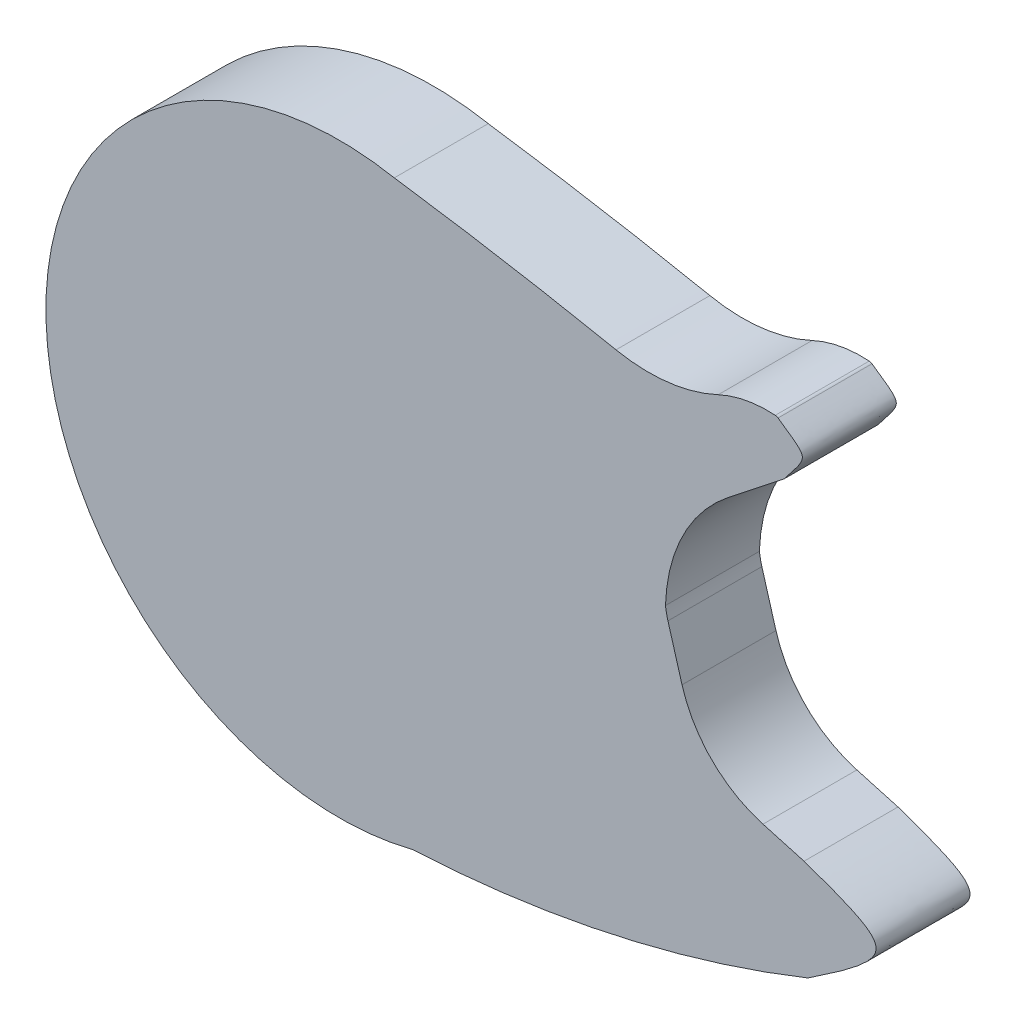
from build123d import *

# Parameters (mm, degrees)
BOSS_EXTRUDE1_DEPTH = 0.4
CUT_EXTRUDE1_DEPTH  = 0.02
CUT_EXTRUDE2_DEPTH  = 0.05


with BuildPart() as part:
    # Sketch1 → Boss-Extrude1 (new body)
    # profile 1 of 3: a face of its own
    with BuildSketch(Plane.XY):
        with BuildLine():
            Line((1.655472948, 0.75976417), (1.894411836, 0.948096738))
            add(Edge.make_bspline(
                [(1.894411836, 0.948096738), (1.995721098, 1.073095376), (1.868209238, 1.159457899)],
                knots=[0, 0, 0, 1, 1, 1], degree=2, weights=[1, 3.709412851, 1]))
            ThreePointArc((1.868209238, 1.159457899), (1.862616141, 1.162248589), (1.856487349, 1.163476835))
            ThreePointArc((1.856487349, 1.163476835), (1.731878841, 1.155950151), (1.613052317, 1.117685434))
            ThreePointArc((1.613052317, 1.117685434), (1.399671578, 1.056795841), (1.177954023, 1.065751723))
            ThreePointArc((1.177954023, 1.065751723), (0.707085833, 1.153787634), (0.233831734, 1.22793433))
            ThreePointArc((0.233831734, 1.22793433), (0.963013413, 0.796934857), (1.25, 0))
            ThreePointArc((1.25, 0), (0.987141366, -0.766845437), (0.309116921, -1.211175763))
            ThreePointArc((0.309116921, -1.211175763), (1.167763583, -1.096895018), (1.995721098, -0.842296251))
            add(Edge.make_bspline(
                [(1.995721098, -0.842296251), (2.410829332, -0.567859808), (1.978844778, -0.419894109)],
                knots=[0, 0, 0, 1, 1, 1], degree=2, weights=[1, 2.377964768, 1]))
            Line((1.978844778, -0.419894109), (1.803929697, -0.370743003))
            ThreePointArc((1.803929697, -0.370743003), (1.587306204, -0.244600422), (1.459129191, -0.029174468))
            Line((1.459129191, -0.029174468), (1.399170684, 0.176735325))
            ThreePointArc((1.399170684, 0.176735325), (1.392988311, 0.201999854), (1.389017546, 0.227704936))
            ThreePointArc((1.389017546, 0.227704936), (1.462895228, 0.523457058), (1.655472948, 0.75976417))
        make_face()
        with BuildLine():
            ThreePointArc((1.387326929, 0.252151163), (1.387922531, 0.23991078), (1.389017546, 0.227704936))
            ThreePointArc((1.389017546, 0.227704936), (1.388794522, 0.208988882), (1.389071983, 0.190273556))
            Line((1.389071983, 0.190273556), (1.387326929, 0.252151163))
        make_face(mode=Mode.SUBTRACT)
    # profile 2 of 3: a face of its own
    with BuildSketch(Plane.XY):
        with BuildLine():
            ThreePointArc((1.389071983, 0.190273556), (1.388794522, 0.208988882), (1.389017546, 0.227704936))
            ThreePointArc((1.389017546, 0.227704936), (1.387922531, 0.23991078), (1.387326929, 0.252151163))
            Line((1.387326929, 0.252151163), (1.389071983, 0.190273556))
        make_face()
    # profile 3 of 3: a face of its own
    with BuildSketch(Plane.XY):
        with BuildLine():
            ThreePointArc((1.25, 0), (0.963013413, 0.796934857), (0.233831734, 1.22793433))
            ThreePointArc((0.233831734, 1.22793433), (-1.249404987, -0.038563937), (0.309116921, -1.211175763))
            ThreePointArc((0.309116921, -1.211175763), (0.987141366, -0.766845437), (1.25, 0))
        make_face()
    extrude(amount=BOSS_EXTRUDE1_DEPTH)

    # Sketch2 → Cut-Extrude1 (cut)
    with BuildSketch(Plane(origin=(0, 0, 0), x_dir=(-1, 0, 0), z_dir=(0, 0, -1))):
        with BuildLine():
            Line((0.430503755, -0.614138842), (-0.508380064, 0.551407028))
            ThreePointArc((-0.508380064, 0.551407028), (-0.584072319, -0.470488604), (0.430503755, -0.614138842))
        make_face()
        with BuildLine():
            ThreePointArc((0.75, 0), (0.346137389, 0.665348712), (-0.430503755, 0.614138842))
            Line((-0.430503755, 0.614138842), (0.508380064, -0.551407028))
            ThreePointArc((0.508380064, -0.551407028), (0.686944338, -0.301010757), (0.75, 0))
        make_face()
    extrude(amount=-CUT_EXTRUDE1_DEPTH, mode=Mode.SUBTRACT)

    # Sketch2<3> → Cut-Extrude2 (cut)
    with BuildSketch(Plane(origin=(0, 0, 0), x_dir=(-1, 0, 0), z_dir=(0, 0, -1))):
        with BuildLine():
            ThreePointArc((-0.430503755, 0.614138842), (-0.450746943, 0.599439065), (-0.470488604, 0.584072319))
            Line((-0.470488604, 0.584072319), (0.470488604, -0.584072319))
            ThreePointArc((0.470488604, -0.584072319), (0.489706772, -0.568055699), (0.508380064, -0.551407028))
            Line((0.508380064, -0.551407028), (-0.430503755, 0.614138842))
        make_face()
        with BuildLine():
            Line((0.470488604, -0.584072319), (-0.470488604, 0.584072319))
            ThreePointArc((-0.470488604, 0.584072319), (-0.489706772, 0.568055699), (-0.508380064, 0.551407028))
            Line((-0.508380064, 0.551407028), (0.430503755, -0.614138842))
            ThreePointArc((0.430503755, -0.614138842), (0.450746943, -0.599439065), (0.470488604, -0.584072319))
        make_face()
    extrude(amount=-CUT_EXTRUDE2_DEPTH, mode=Mode.SUBTRACT)


solid = part.part
